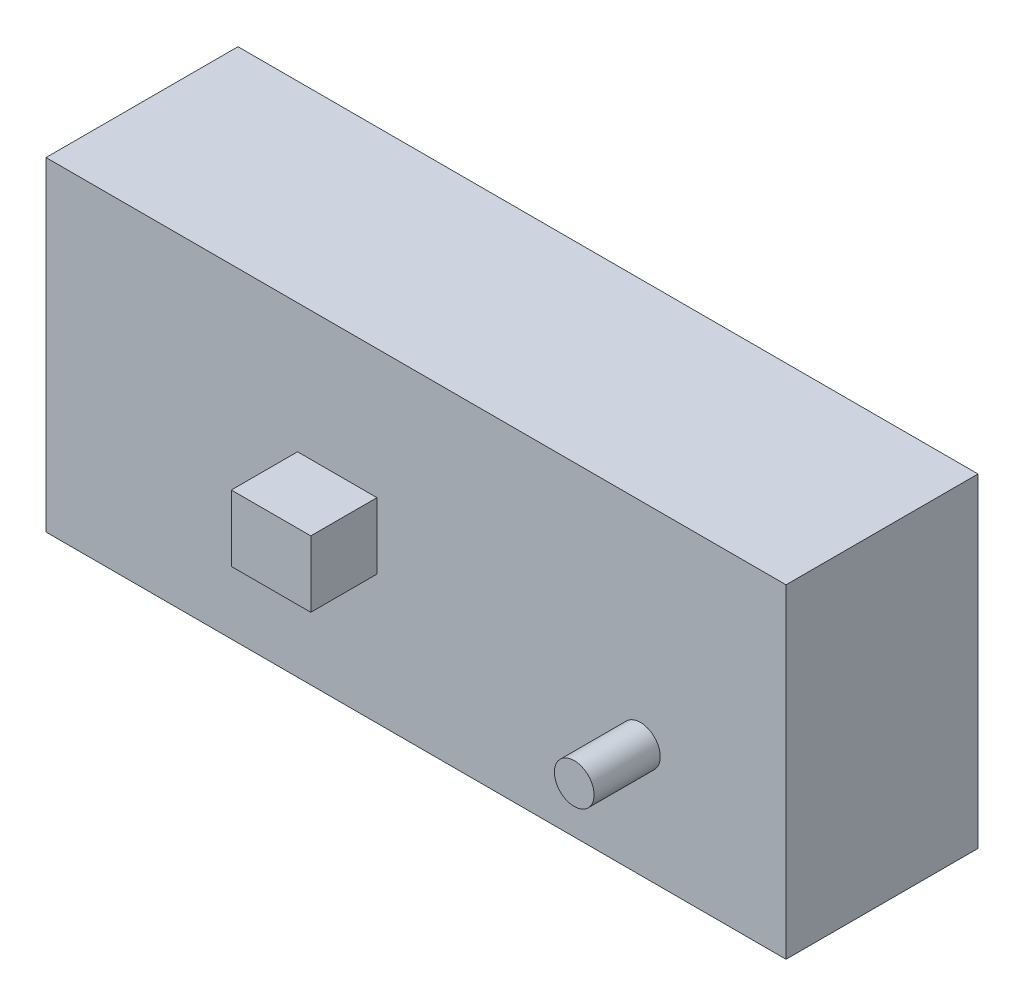
from build123d import *

# Parameters (mm, degrees)
SKETCH1_W           = 70.993
SKETCH1_H           = 31.115
BOSS_EXTRUDE1_DEPTH = 18.415
SKETCH2_R           = 1.905
SKETCH2_W           = 7.62
SKETCH2_H           = 6.35
BOSS_EXTRUDE2_DEPTH = 6.35
SKETCH3_R           = 5.715
CUT_EXTRUDE1_DEPTH  = 2.54


with BuildPart() as part:
    # Sketch1 → Boss-Extrude1 (new body)
    with BuildSketch(Plane.XY):
        with Locations((35.4965, 15.5575)):
            Rectangle(SKETCH1_W, SKETCH1_H)
    extrude(amount=BOSS_EXTRUDE1_DEPTH)

    # Sketch2 → Boss-Extrude2 (add)
    with BuildSketch(Plane.XY.offset(18.415)):
        with Locations(Location((57.023, 10.794999954, 0), (0, 0, 180))):
            Circle(SKETCH2_R)
        with Locations((27.94, 15.5575)):
            Rectangle(SKETCH2_W, SKETCH2_H)
    extrude(amount=BOSS_EXTRUDE2_DEPTH)

    # Sketch3 → Cut-Extrude1 (cut)
    with BuildSketch(Plane(origin=(0, 0, 0), x_dir=(-1, 0, 0), z_dir=(0, 0, -1))):
        with Locations((-19.05, 15.5575)):
            Circle(SKETCH3_R)
    extrude(amount=-CUT_EXTRUDE1_DEPTH, mode=Mode.SUBTRACT)


solid = part.part
